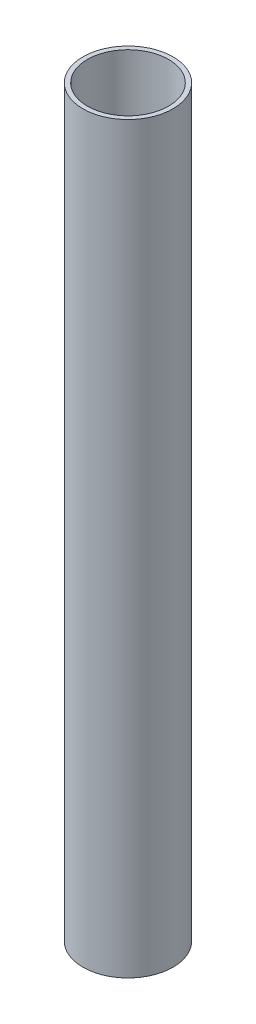
from build123d import *

# Parameters (mm, degrees)
CROQUIS1_R              = 20
CROQUIS1_R_2            = 18
SALIENTE_EXTRUIR1_DEPTH = 330


with BuildPart() as part:
    # Croquis1 → Saliente-Extruir1 (new body)
    with BuildSketch(Plane(origin=(0, 0, 0), x_dir=(1, 0, 0), z_dir=(0, 1, 0))):
        with Locations(Location((0, 0, 0), (0, 0, 270))):
            Circle(CROQUIS1_R)
        with Locations(Location((0, 0, 0), (0, 0, 270))):
            Circle(CROQUIS1_R_2, mode=Mode.SUBTRACT)
    extrude(amount=SALIENTE_EXTRUIR1_DEPTH)


solid = part.part
